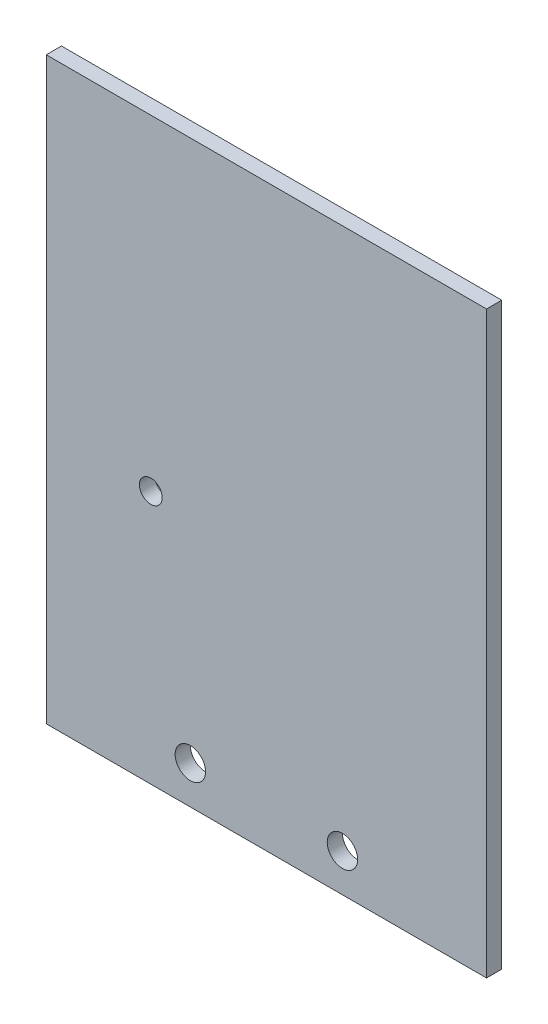
from build123d import *

# Parameters (mm, degrees)
SKETCH1_W           = 57.9
SKETCH1_H           = 76.2
BOSS_EXTRUDE1_DEPTH = 2
SKETCH2_R           = 2
SKETCH2_W           = 12
SKETCH2_H           = 10
SKETCH2_R_2         = 1.5
CUT_EXTRUDE1_DEPTH  = 2
SKETCH4_R           = 2
SKETCH4_R_2         = 1.5
SKETCH4_R_3         = 1.957178151
BOSS_EXTRUDE5_DEPTH = 2
SKETCH8_W           = 57.9
SKETCH8_H           = 76.2
SKETCH8_R           = 2
SKETCH8_R_2         = 1.5
SKETCH8_W_2         = 12
SKETCH8_H_2         = 10
BOSS_EXTRUDE6_DEPTH = 10
SKETCH9_R           = 2
CUT_EXTRUDE6_DEPTH  = 10
SKETCH10_W          = 57.9
SKETCH10_H          = 76.2
CUT_EXTRUDE7_DEPTH  = 10
SKETCH11_W          = 45.093614326
SKETCH11_H          = 27.476395826
BOSS_EXTRUDE7_DEPTH = 2


with BuildPart() as part:
    # Sketch1 → Boss-Extrude1 (new body)
    with BuildSketch(Plane.XY):
        with Locations((-6.590392234, -8.896581688)):
            Rectangle(SKETCH1_W, SKETCH1_H)
    extrude(amount=BOSS_EXTRUDE1_DEPTH)

    # Sketch2 → Cut-Extrude1 (cut)
    with BuildSketch(Plane(origin=(0, 0, 0), x_dir=(-1, 0, 0), z_dir=(0, 0, -1))):
        with Locations((-6.409607766, 14.203418312)):
            Circle(SKETCH2_R)
        with Locations((19.590392234, 14.203418312)):
            Circle(SKETCH2_R)
        with Locations((2.640392234, 4.203418312)):
            Rectangle(SKETCH2_W, SKETCH2_H)
        with Locations((16.590392234, -41.996581688)):
            Circle(SKETCH2_R)
        with Locations((-3.409607766, -41.996581688)):
            Circle(SKETCH2_R)
        with Locations((21.790392234, -13.626581688)):
            Circle(SKETCH2_R_2)
    extrude(amount=-CUT_EXTRUDE1_DEPTH, mode=Mode.SUBTRACT)

    # Sketch4 → Boss-Extrude5 (add)
    # profile 1 of 3: a face of its own
    with BuildSketch(Plane(origin=(0, 0, 0), x_dir=(-1, 0, 0), z_dir=(0, 0, -1))):
        Polygon((35.540392234, 29.203418312), (6.590392234, 29.203418312), (-22.359607766, 29.203418312), (-22.359607766, -46.996581688), (35.540392234, -46.996581688), align=None)
        with Locations((-3.409607766, -41.996581688)):
            Circle(SKETCH4_R, mode=Mode.SUBTRACT)
        with Locations((16.590392234, -41.996581688)):
            Circle(SKETCH4_R, mode=Mode.SUBTRACT)
        with Locations((21.790392234, -13.626581688)):
            Circle(SKETCH4_R_2, mode=Mode.SUBTRACT)
        Polygon((-13.650237399, 24.487372027), (6.590392234, 24.487372027), (30.150370064, 24.487372027), (30.150370064, 9.203418312), (8.640392234, 9.203418312), (8.640392234, -0.796581688), (-3.359607766, -0.796581688), (-3.359607766, 9.203418312), (-13.650237399, 9.203418312), align=None, mode=Mode.SUBTRACT)
    # profile 2 of 3: a face of its own
    with BuildSketch(Plane(origin=(0, 0, 0), x_dir=(-1, 0, 0), z_dir=(0, 0, -1))):
        with Locations((-6.409607766, 14.203418312)):
            Circle(SKETCH4_R)
    # profile 3 of 3: a face of its own
    with BuildSketch(Plane(origin=(0, 0, 0), x_dir=(-1, 0, 0), z_dir=(0, 0, -1))):
        with Locations((19.590392234, 14.203418312)):
            Circle(SKETCH4_R_3)
    extrude(amount=-BOSS_EXTRUDE5_DEPTH)


with BuildPart() as boss_extrude5_piece_1:
    # of the separate pieces the step leaves, piece 1, a body of its own (boss_extrude5_pieces)
    add(part.part.solids().sort_by_distance((-35.540392234, 29.203418312, 0))[0])



with BuildPart() as boss_extrude5_piece_2:
    # of the separate pieces the step leaves, piece 2, a body of its own (boss_extrude5_pieces)
    add(part.part.solids().sort_by_distance((-21.547570385, 14.203418312, 0))[0])


with BuildPart() as boss_extrude5_piece_1_1:
    add(boss_extrude5_piece_1.part)

    add(boss_extrude5_piece_2.part)  # Boss-Extrude6 merges Boss-Extrude5 piece 2
    # Sketch8 → Boss-Extrude6 (add)
    # profile 1 of 2: a face of its own
    with BuildSketch(Plane(origin=(0, 0, 0), x_dir=(-1, 0, 0), z_dir=(0, 0, -1))):
        with Locations((6.590392234, -8.896581688)):
            Rectangle(SKETCH8_W, SKETCH8_H)
        with Locations((16.590392234, -41.996581688)):
            Circle(SKETCH8_R, mode=Mode.SUBTRACT)
        with Locations((21.790392234, -13.626581688)):
            Circle(SKETCH8_R_2, mode=Mode.SUBTRACT)
        with Locations((19.590392234, 14.203418312)):
            Circle(SKETCH8_R, mode=Mode.SUBTRACT)
        with Locations((-3.409607766, -41.996581688)):
            Circle(SKETCH8_R, mode=Mode.SUBTRACT)
        with Locations((2.640392234, 4.203418312)):
            Rectangle(SKETCH8_W_2, SKETCH8_H_2, mode=Mode.SUBTRACT)
    # profile 2 of 2: a face of its own
    with BuildSketch(Plane(origin=(0, 0, 0), x_dir=(-1, 0, 0), z_dir=(0, 0, -1))):
        with Locations((19.590392234, 14.203418312)):
            Circle(SKETCH8_R)
    extrude(amount=BOSS_EXTRUDE6_DEPTH)

    # Sketch9 → Cut-Extrude6 (cut)
    with BuildSketch(Plane(origin=(0, 0, -10), x_dir=(-1, 0, 0), z_dir=(0, 0, -1))):
        with Locations((-6.468155069, 18.203418312)):
            Circle(SKETCH9_R)
        with Locations((19.531844931, 18.203418312)):
            Circle(SKETCH9_R)
    extrude(amount=-CUT_EXTRUDE6_DEPTH, mode=Mode.SUBTRACT)

    # Sketch10 → Cut-Extrude7 (cut)
    with BuildSketch(Plane.XY.offset(2)):
        with Locations((-6.590392234, -8.896581688)):
            Rectangle(SKETCH10_W, SKETCH10_H)
    extrude(amount=-CUT_EXTRUDE7_DEPTH, mode=Mode.SUBTRACT)

    # Sketch11 → Boss-Extrude7 (add)
    with BuildSketch(Plane.XY.offset(-8)):
        with Locations((-7.118685328, 9.132915536)):
            Rectangle(SKETCH11_W, SKETCH11_H)
    extrude(amount=-BOSS_EXTRUDE7_DEPTH)


solid = boss_extrude5_piece_1_1.part
